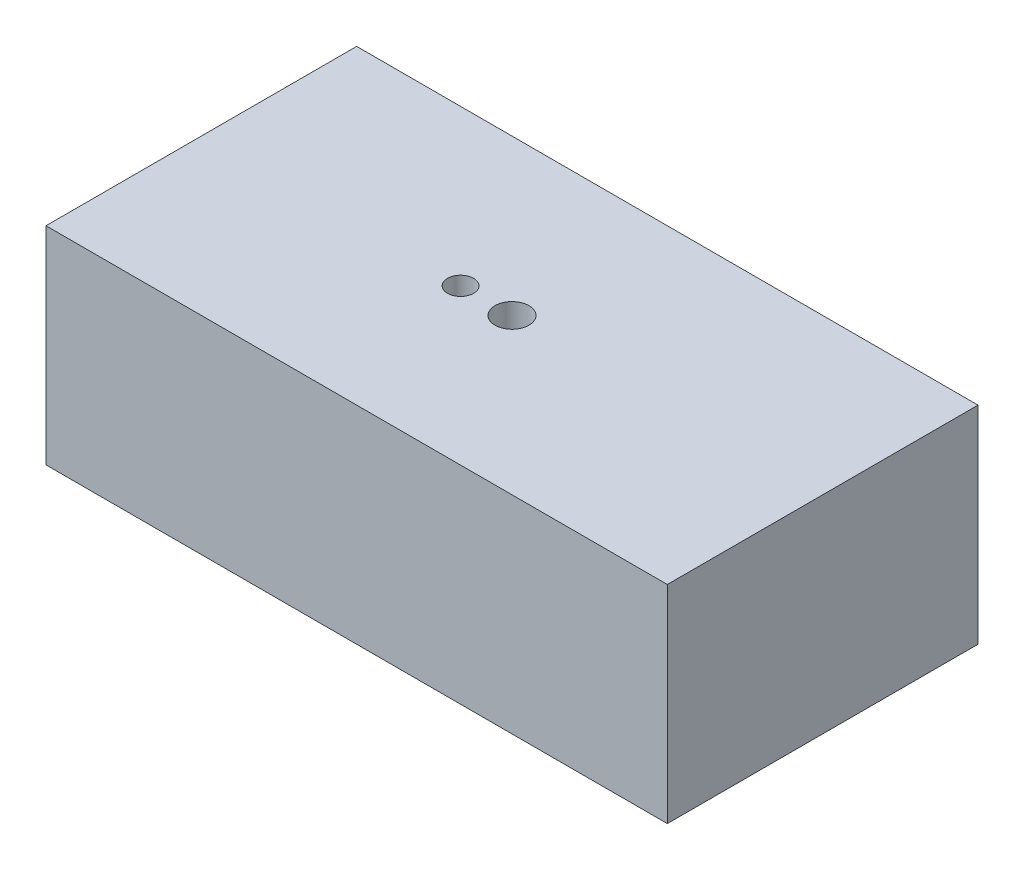
from build123d import *

# Parameters (mm, degrees)
SKETCH1_W           = 30
SKETCH1_H           = 15
SKETCH1_R           = 0.82
SKETCH1_R_2         = 0.63
BOSS_EXTRUDE1_DEPTH = 10


with BuildPart() as part:
    # Sketch1 → Boss-Extrude1 (new body)
    with BuildSketch(Plane(origin=(0, 0, 0), x_dir=(1, 0, 0), z_dir=(0, 1, 0))):
        Rectangle(SKETCH1_W, SKETCH1_H)
        with Locations(Location((0, 0, 0), (0, 0, 270))):
            Circle(SKETCH1_R, mode=Mode.SUBTRACT)
        with Locations(Location((-2.479995619, -0.004661312, 0), (0, 0, 270))):
            Circle(SKETCH1_R_2, mode=Mode.SUBTRACT)
    extrude(amount=BOSS_EXTRUDE1_DEPTH)


solid = part.part
